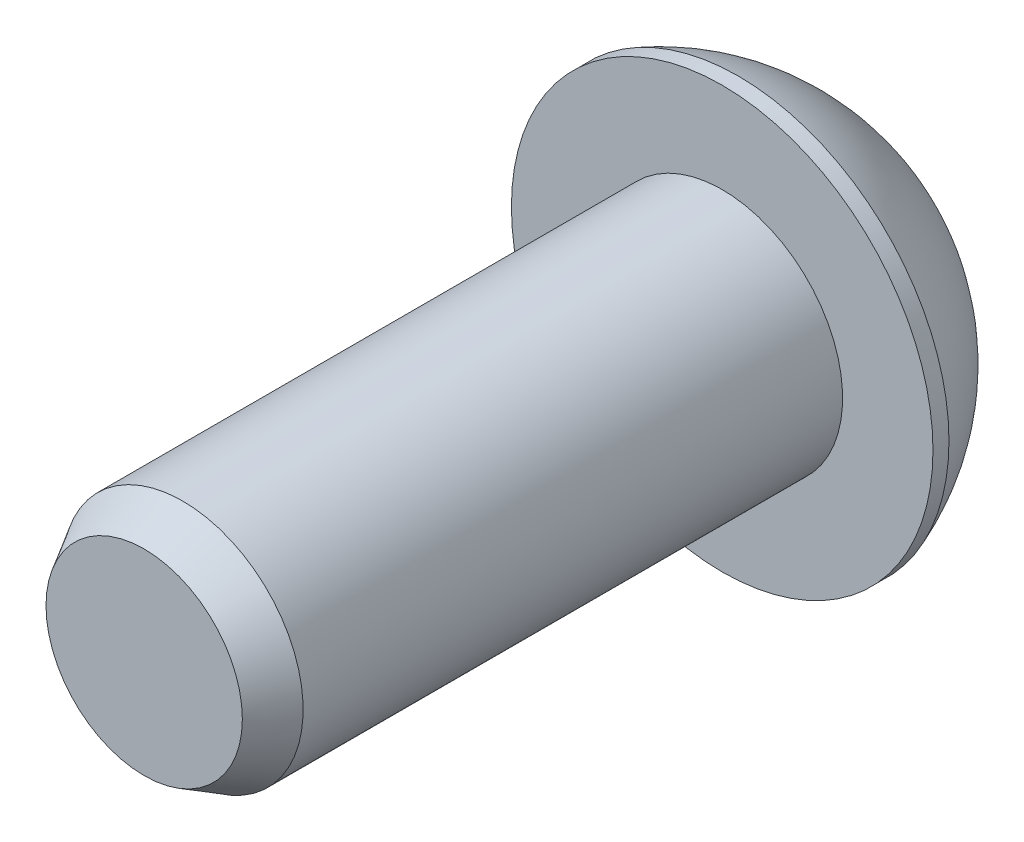
from build123d import *

# Parameters (mm, degrees)
CUT_EXTRUDE1_DEPTH  = 2.2225
SKETCH3_R           = 3.96875
BOSS_EXTRUDE1_DEPTH = 19.05
CHAMFER1_SIZE       = 1.27
CHAMFER1_SIZE2      = 0.733234842


with BuildPart() as part:
    # Sketch1 → Revolve1 (revolve)
    with BuildSketch(Plane(origin=(0, 0, 0), x_dir=(1, 0, 0), z_dir=(0, 1, 0))):
        with BuildLine():
            Line((6.946899945, -4.2164), (6.946899945, -3.689349932))
            ThreePointArc((6.946899945, -3.689349932), (5.758127461, -1.59917681), (3.962399967, 0))
            Line((3.962399967, 0), (-2.8e-08, 0))
            Line((-2.8e-08, 0), (-2.8e-08, -4.2164))
            Line((-2.8e-08, -4.2164), (6.946899945, -4.2164))
        make_face()
    revolve(axis=Axis((-2.8e-08, 0, 0), (0, 0, -1)))

    # Sketch2 → Cut-Extrude1 (cut)
    with BuildSketch(Plane(origin=(0, 0, 0), x_dir=(-1, 0, 0), z_dir=(0, 0, -1))):
        Polygon((2.749630657, 0), (1.374815329, 2.38125), (-1.374815329, 2.38125), (-2.749630657, 0), (-1.374815329, -2.38125), (1.374815329, -2.38125), align=None)
    extrude(amount=-CUT_EXTRUDE1_DEPTH, mode=Mode.SUBTRACT)

    # Sketch3 → Boss-Extrude1 (add)
    with BuildSketch(Plane.XY.offset(4.2164)):
        with Locations(Location((0, 0, 0), (0, 0, 180))):
            Circle(SKETCH3_R)
    extrude(amount=BOSS_EXTRUDE1_DEPTH)

    # Chamfer1
    chamfer1_edges = [part.edges().sort_by_distance(p)[0] for p in [
        (3.96875, 0, 23.2664),
    ]]
    chamfer1_side = [part.faces().sort_by_distance(p)[0] for p in [
        (3.96875, 0, 13.7414),
    ]]
    chamfer(chamfer1_edges, length=CHAMFER1_SIZE, length2=CHAMFER1_SIZE2, reference=chamfer1_side[0])


solid = part.part
